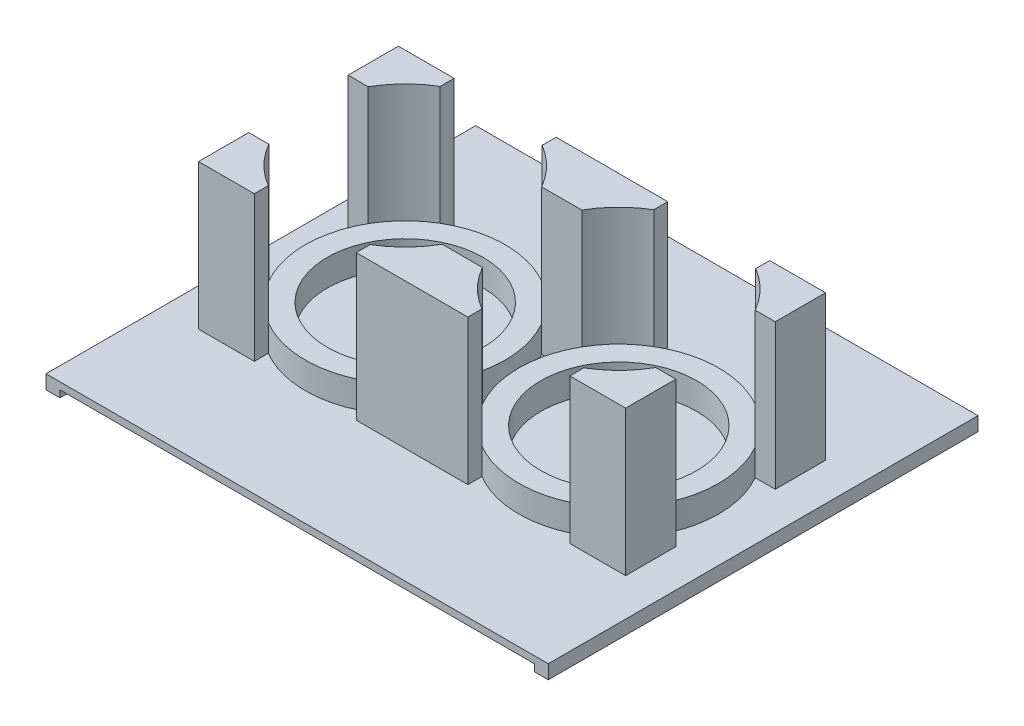
from build123d import *

# Parameters (mm, degrees)
SKETCH1_W           = 85
SKETCH1_H           = 77
BOSS_EXTRUDE1_DEPTH = 1.25
SKETCH3_R           = 17.907
SKETCH3_R_2         = 13.97
BOSS_EXTRUDE3_DEPTH = 4.7625
BOSS_EXTRUDE7_DEPTH = 26
SKETCH6_W           = 77
SKETCH6_H           = 2.5
BOSS_EXTRUDE8_DEPTH = 2.5


with BuildPart() as part:
    # Sketch1 → Boss-Extrude1 (new body)
    with BuildSketch(Plane(origin=(0, 0, 0), x_dir=(1, 0, 0), z_dir=(0, 1, 0))):
        Rectangle(SKETCH1_W, SKETCH1_H)
    extrude(amount=BOSS_EXTRUDE1_DEPTH)

    # Sketch3 → Boss-Extrude3 (add)
    # profile 1 of 2: a face of its own
    with BuildSketch(Plane(origin=(0, 1.25, 0), x_dir=(1, 0, 0), z_dir=(0, 1, 0))):
        with Locations(Location((19.133331774, 0, 0), (0, 0, 90))):
            Circle(SKETCH3_R)
        with Locations(Location((19.133331774, 0, 0), (0, 0, 90))):
            Circle(SKETCH3_R_2, mode=Mode.SUBTRACT)
    # profile 2 of 2: a face of its own
    with BuildSketch(Plane(origin=(0, 1.25, 0), x_dir=(1, 0, 0), z_dir=(0, 1, 0))):
        with Locations(Location((-19.133331774, 0, 0), (0, 0, 90))):
            Circle(SKETCH3_R)
        with Locations(Location((-19.133331774, 0, 0), (0, 0, 90))):
            Circle(SKETCH3_R_2, mode=Mode.SUBTRACT)
    extrude(amount=BOSS_EXTRUDE3_DEPTH)

    # Sketch4 → Boss-Extrude7 (add)
    with BuildSketch(Plane(origin=(0, 1.25, 0), x_dir=(1, 0, 0), z_dir=(0, 1, 0))):
        with BuildLine():
            ThreePointArc((-34.668002675, 8.907), (-31.887785522, 12.569190849), (-28.266663548, 15.402691314))
            Line((-28.266663548, 15.402691314), (-28.266663548, 17.907))
            Line((-28.266663548, 17.907), (-38.266663548, 17.907))
            Line((-38.266663548, 17.907), (-38.266663548, 8.907))
            Line((-38.266663548, 8.907), (-34.668002675, 8.907))
        make_face()
        with BuildLine():
            ThreePointArc((-28.266663548, -15.402691314), (-31.887785522, -12.569190849), (-34.668002675, -8.907))
            Line((-34.668002675, -8.907), (-38.266663548, -8.907))
            Line((-38.266663548, -8.907), (-38.266663548, -17.907))
            Line((-38.266663548, -17.907), (-28.266663548, -17.907))
            Line((-28.266663548, -17.907), (-28.266663548, -15.402691314))
        make_face()
        with BuildLine():
            Line((0, -8.907), (-3.598660873, -8.907))
            ThreePointArc((-3.598660873, -8.907), (-6.378878026, -12.569190849), (-10, -15.402691314))
            Line((-10, -15.402691314), (-10, -17.907))
            Line((-10, -17.907), (0, -17.907))
            Line((0, -17.907), (0, -8.907))
        make_face()
        with BuildLine():
            ThreePointArc((10, -15.402691314), (6.378878026, -12.569190849), (3.598660873, -8.907))
            Line((3.598660873, -8.907), (0, -8.907))
            Line((0, -8.907), (0, -17.907))
            Line((0, -17.907), (10, -17.907))
            Line((10, -17.907), (10, -15.402691314))
        make_face()
        with BuildLine():
            Line((0, 8.907), (0, 17.907))
            Line((0, 17.907), (-10, 17.907))
            Line((-10, 17.907), (-10, 15.402691314))
            ThreePointArc((-10, 15.402691314), (-6.378878026, 12.569190849), (-3.598660873, 8.907))
            Line((-3.598660873, 8.907), (0, 8.907))
        make_face()
        with BuildLine():
            Line((10, 17.907), (0, 17.907))
            Line((0, 17.907), (0, 8.907))
            Line((0, 8.907), (3.598660873, 8.907))
            ThreePointArc((3.598660873, 8.907), (6.378878026, 12.569190849), (10, 15.402691314))
            Line((10, 15.402691314), (10, 17.907))
        make_face()
        with BuildLine():
            Line((28.266663548, 17.907), (28.266663548, 15.402691314))
            ThreePointArc((28.266663548, 15.402691314), (31.887785522, 12.569190849), (34.668002675, 8.907))
            Line((34.668002675, 8.907), (38.266663548, 8.907))
            Line((38.266663548, 8.907), (38.266663548, 17.907))
            Line((38.266663548, 17.907), (28.266663548, 17.907))
        make_face()
        with BuildLine():
            ThreePointArc((34.668002675, -8.907), (31.887785522, -12.569190849), (28.266663548, -15.402691314))
            Line((28.266663548, -15.402691314), (28.266663548, -17.907))
            Line((28.266663548, -17.907), (38.266663548, -17.907))
            Line((38.266663548, -17.907), (38.266663548, -8.907))
            Line((38.266663548, -8.907), (34.668002675, -8.907))
        make_face()
    extrude(amount=BOSS_EXTRUDE7_DEPTH)

    # Sketch6 → Boss-Extrude8 (add)
    with BuildSketch(Plane.ZY.offset(42.5)):
        Rectangle(SKETCH6_W, SKETCH6_H)
    boss_extrude8 = extrude(amount=BOSS_EXTRUDE8_DEPTH)

    # Mirror1: Boss-Extrude8 across plane
    add(boss_extrude8.mirror(Plane(origin=(0, 0, 0), x_dir=(0, 0, 1), z_dir=(1, 0, 0))))


solid = part.part
